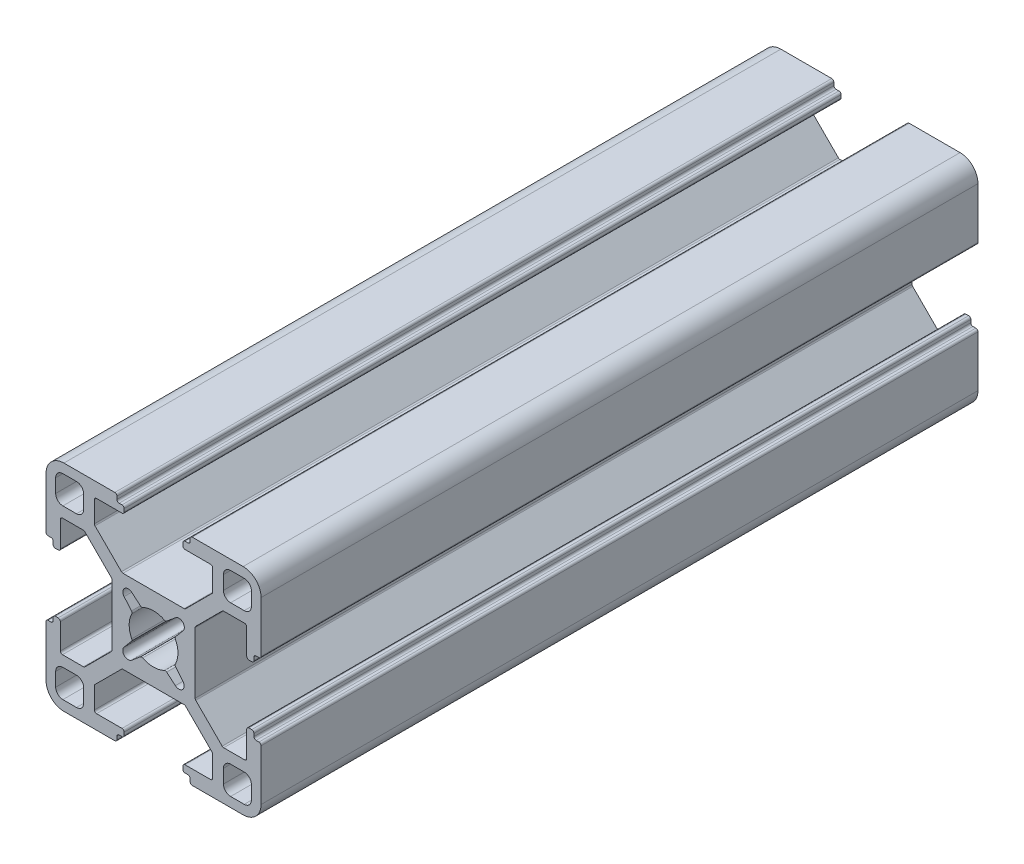
from build123d import *

# Parameters (mm, degrees)
EXTRUDE_1_DEPTH = 100


with BuildPart() as part:
    # 草图1 → 凸台-拉伸1 (new body)
    with BuildSketch(Plane.XY):
        with BuildLine():
            Line((14.3, 5.1), (14.7, 5.1))
            ThreePointArc((14.7, 5.1), (14.912132034, 5.187867966), (15, 5.4))
            Line((15, 5.4), (15, 12.5))
            ThreePointArc((15, 12.5), (14.267766953, 14.267766953), (12.5, 15))
            Line((12.5, 15), (5.4, 15))
            ThreePointArc((5.4, 15), (5.187867966, 14.912132034), (5.1, 14.7))
            Line((5.1, 14.7), (5.1, 14.3))
            ThreePointArc((5.1, 14.3), (5.012132034, 14.087867966), (4.8, 14))
            Line((4.8, 14), (4.4, 14))
            ThreePointArc((4.4, 14), (4.187867966, 13.912132034), (4.1, 13.7))
            Line((4.1, 13.7), (4.1, 13.3))
            ThreePointArc((4.1, 13.3), (4.187867966, 13.087867966), (4.4, 13))
            Line((4.4, 13), (7.95, 13))
            ThreePointArc((7.95, 13), (8.162132034, 12.912132034), (8.25, 12.7))
            Line((8.25, 12.7), (8.25, 9.788477631))
            ThreePointArc((8.25, 9.788477631), (8.22716386, 9.673672601), (8.162132034, 9.576345597))
            Line((8.162132034, 9.576345597), (4.473654403, 5.887867966))
            ThreePointArc((4.473654403, 5.887867966), (4.376327399, 5.82283614), (4.261522369, 5.8))
            Line((4.261522369, 5.8), (0, 5.8))
            Line((0, 5.8), (-4.261522369, 5.8))
            ThreePointArc((-4.261522369, 5.8), (-4.376327399, 5.82283614), (-4.473654403, 5.887867966))
            Line((-4.473654403, 5.887867966), (-8.162132034, 9.576345597))
            ThreePointArc((-8.162132034, 9.576345597), (-8.22716386, 9.673672601), (-8.25, 9.788477631))
            Line((-8.25, 9.788477631), (-8.25, 12.7))
            ThreePointArc((-8.25, 12.7), (-8.162132034, 12.912132034), (-7.95, 13))
            Line((-7.95, 13), (-4.4, 13))
            ThreePointArc((-4.4, 13), (-4.187867966, 13.087867966), (-4.1, 13.3))
            Line((-4.1, 13.3), (-4.1, 13.7))
            ThreePointArc((-4.1, 13.7), (-4.187867966, 13.912132034), (-4.4, 14))
            Line((-4.4, 14), (-4.8, 14))
            ThreePointArc((-4.8, 14), (-5.012132034, 14.087867966), (-5.1, 14.3))
            Line((-5.1, 14.3), (-5.1, 14.7))
            ThreePointArc((-5.1, 14.7), (-5.187867966, 14.912132034), (-5.4, 15))
            Line((-5.4, 15), (-12.5, 15))
            ThreePointArc((-12.5, 15), (-14.267766953, 14.267766953), (-15, 12.5))
            Line((-15, 12.5), (-15, 5.4))
            ThreePointArc((-15, 5.4), (-14.912132034, 5.187867966), (-14.7, 5.1))
            Line((-14.7, 5.1), (-14.3, 5.1))
            ThreePointArc((-14.3, 5.1), (-14.087867966, 5.012132034), (-14, 4.8))
            Line((-14, 4.8), (-14, 4.4))
            ThreePointArc((-14, 4.4), (-13.912132034, 4.187867966), (-13.7, 4.1))
            Line((-13.7, 4.1), (-13.3, 4.1))
            ThreePointArc((-13.3, 4.1), (-13.087867966, 4.187867966), (-13, 4.4))
            Line((-13, 4.4), (-13, 7.95))
            ThreePointArc((-13, 7.95), (-12.912132034, 8.162132034), (-12.7, 8.25))
            Line((-12.7, 8.25), (-9.788477631, 8.25))
            ThreePointArc((-9.788477631, 8.25), (-9.673672601, 8.22716386), (-9.576345597, 8.162132034))
            Line((-9.576345597, 8.162132034), (-5.887867966, 4.473654403))
            ThreePointArc((-5.887867966, 4.473654403), (-5.82283614, 4.376327399), (-5.8, 4.261522369))
            Line((-5.8, 4.261522369), (-5.8, 0))
            Line((-5.8, 0), (-5.8, -4.261522369))
            ThreePointArc((-5.8, -4.261522369), (-5.82283614, -4.376327399), (-5.887867966, -4.473654403))
            Line((-5.887867966, -4.473654403), (-9.576345597, -8.162132034))
            ThreePointArc((-9.576345597, -8.162132034), (-9.673672601, -8.22716386), (-9.788477631, -8.25))
            Line((-9.788477631, -8.25), (-12.7, -8.25))
            ThreePointArc((-12.7, -8.25), (-12.912132034, -8.162132034), (-13, -7.95))
            Line((-13, -7.95), (-13, -4.4))
            ThreePointArc((-13, -4.4), (-13.087867966, -4.187867966), (-13.3, -4.1))
            Line((-13.3, -4.1), (-13.7, -4.1))
            ThreePointArc((-13.7, -4.1), (-13.912132034, -4.187867966), (-14, -4.4))
            Line((-14, -4.4), (-14, -4.8))
            ThreePointArc((-14, -4.8), (-14.087867966, -5.012132034), (-14.3, -5.1))
            Line((-14.3, -5.1), (-14.7, -5.1))
            ThreePointArc((-14.7, -5.1), (-14.912132034, -5.187867966), (-15, -5.4))
            Line((-15, -5.4), (-15, -12.5))
            ThreePointArc((-15, -12.5), (-14.267766953, -14.267766953), (-12.5, -15))
            Line((-12.5, -15), (-5.4, -15))
            ThreePointArc((-5.4, -15), (-5.187867966, -14.912132034), (-5.1, -14.7))
            Line((-5.1, -14.7), (-5.1, -14.3))
            ThreePointArc((-5.1, -14.3), (-5.012132034, -14.087867966), (-4.8, -14))
            Line((-4.8, -14), (-4.4, -14))
            ThreePointArc((-4.4, -14), (-4.187867966, -13.912132034), (-4.1, -13.7))
            Line((-4.1, -13.7), (-4.1, -13.3))
            ThreePointArc((-4.1, -13.3), (-4.187867966, -13.087867966), (-4.4, -13))
            Line((-4.4, -13), (-7.95, -13))
            ThreePointArc((-7.95, -13), (-8.162132034, -12.912132034), (-8.25, -12.7))
            Line((-8.25, -12.7), (-8.25, -9.664213562))
            Line((-8.25, -9.664213562), (-4.385786438, -5.8))
            Line((-4.385786438, -5.8), (0, -5.8))
            Line((0, -5.8), (4.385786438, -5.8))
            Line((4.385786438, -5.8), (8.162132034, -9.576345597))
            ThreePointArc((8.162132034, -9.576345597), (8.22716386, -9.673672601), (8.25, -9.788477631))
            Line((8.25, -9.788477631), (8.25, -12.7))
            ThreePointArc((8.25, -12.7), (8.162132034, -12.912132034), (7.95, -13))
            Line((7.95, -13), (4.4, -13))
            ThreePointArc((4.4, -13), (4.187867966, -13.087867966), (4.1, -13.3))
            Line((4.1, -13.3), (4.1, -13.7))
            ThreePointArc((4.1, -13.7), (4.187867966, -13.912132034), (4.4, -14))
            Line((4.4, -14), (4.8, -14))
            ThreePointArc((4.8, -14), (5.012132034, -14.087867966), (5.1, -14.3))
            Line((5.1, -14.3), (5.1, -14.7))
            ThreePointArc((5.1, -14.7), (5.187867966, -14.912132034), (5.4, -15))
            Line((5.4, -15), (12.5, -15))
            ThreePointArc((12.5, -15), (14.267766953, -14.267766953), (15, -12.5))
            Line((15, -12.5), (15, -5.4))
            ThreePointArc((15, -5.4), (14.912132034, -5.187867966), (14.7, -5.1))
            Line((14.7, -5.1), (14.3, -5.1))
            ThreePointArc((14.3, -5.1), (14.087867966, -5.012132034), (14, -4.8))
            Line((14, -4.8), (14, -4.4))
            ThreePointArc((14, -4.4), (13.912132034, -4.187867966), (13.7, -4.1))
            Line((13.7, -4.1), (13.3, -4.1))
            ThreePointArc((13.3, -4.1), (13.087867966, -4.187867966), (13, -4.4))
            Line((13, -4.4), (13, -7.95))
            ThreePointArc((13, -7.95), (12.912132034, -8.162132034), (12.7, -8.25))
            Line((12.7, -8.25), (9.788477631, -8.25))
            ThreePointArc((9.788477631, -8.25), (9.673672601, -8.22716386), (9.576345597, -8.162132034))
            Line((9.576345597, -8.162132034), (5.887867966, -4.473654403))
            ThreePointArc((5.887867966, -4.473654403), (5.82283614, -4.376327399), (5.8, -4.261522369))
            Line((5.8, -4.261522369), (5.8, 0))
            Line((5.8, 0), (5.8, 4.261522369))
            ThreePointArc((5.8, 4.261522369), (5.82283614, 4.376327399), (5.887867966, 4.473654403))
            Line((5.887867966, 4.473654403), (9.576345597, 8.162132034))
            ThreePointArc((9.576345597, 8.162132034), (9.673672601, 8.22716386), (9.788477631, 8.25))
            Line((9.788477631, 8.25), (12.7, 8.25))
            ThreePointArc((12.7, 8.25), (12.912132034, 8.162132034), (13, 7.95))
            Line((13, 7.95), (13, 4.4))
            ThreePointArc((13, 4.4), (13.087867966, 4.187867966), (13.3, 4.1))
            Line((13.3, 4.1), (13.7, 4.1))
            ThreePointArc((13.7, 4.1), (13.912132034, 4.187867966), (14, 4.4))
            Line((14, 4.4), (14, 4.8))
            ThreePointArc((14, 4.8), (14.087867966, 5.012132034), (14.3, 5.1))
        make_face()
        with BuildLine():
            Line((-13.65, 12.65), (-13.65, 10.75))
            ThreePointArc((-13.65, 10.75), (-13.357106781, 10.042893219), (-12.65, 9.75))
            Line((-12.65, 9.75), (-10.75, 9.75))
            ThreePointArc((-10.75, 9.75), (-10.042893219, 10.042893219), (-9.75, 10.75))
            Line((-9.75, 10.75), (-9.75, 12.65))
            ThreePointArc((-9.75, 12.65), (-10.042893219, 13.357106781), (-10.75, 13.65))
            Line((-10.75, 13.65), (-12.65, 13.65))
            ThreePointArc((-12.65, 13.65), (-13.357106781, 13.357106781), (-13.65, 12.65))
        make_face(mode=Mode.SUBTRACT)
        with BuildLine():
            Line((12.65, 13.65), (10.75, 13.65))
            ThreePointArc((10.75, 13.65), (10.042893219, 13.357106781), (9.75, 12.65))
            Line((9.75, 12.65), (9.75, 10.75))
            ThreePointArc((9.75, 10.75), (10.042893219, 10.042893219), (10.75, 9.75))
            Line((10.75, 9.75), (12.65, 9.75))
            ThreePointArc((12.65, 9.75), (13.357106781, 10.042893219), (13.65, 10.75))
            Line((13.65, 10.75), (13.65, 12.65))
            ThreePointArc((13.65, 12.65), (13.357106781, 13.357106781), (12.65, 13.65))
        make_face(mode=Mode.SUBTRACT)
        with BuildLine():
            Line((-12.65, -13.65), (-10.75, -13.65))
            ThreePointArc((-10.75, -13.65), (-10.042893219, -13.357106781), (-9.75, -12.65))
            Line((-9.75, -12.65), (-9.75, -10.75))
            ThreePointArc((-9.75, -10.75), (-10.042893219, -10.042893219), (-10.75, -9.75))
            Line((-10.75, -9.75), (-12.65, -9.75))
            ThreePointArc((-12.65, -9.75), (-13.357106781, -10.042893219), (-13.65, -10.75))
            Line((-13.65, -10.75), (-13.65, -12.65))
            ThreePointArc((-13.65, -12.65), (-13.357106781, -13.357106781), (-12.65, -13.65))
        make_face(mode=Mode.SUBTRACT)
        with BuildLine():
            Line((9.75, -10.75), (9.75, -12.65))
            ThreePointArc((9.75, -12.65), (10.042893219, -13.357106781), (10.75, -13.65))
            Line((10.75, -13.65), (12.65, -13.65))
            ThreePointArc((12.65, -13.65), (13.357106781, -13.357106781), (13.65, -12.65))
            Line((13.65, -12.65), (13.65, -10.75))
            ThreePointArc((13.65, -10.75), (13.357106781, -10.042893219), (12.65, -9.75))
            Line((12.65, -9.75), (10.75, -9.75))
            ThreePointArc((10.75, -9.75), (10.042893219, -10.042893219), (9.75, -10.75))
        make_face(mode=Mode.SUBTRACT)
        with BuildLine():
            Line((-1.830036904, 3.088942258), (-3.049302452, 4.116700743))
            ThreePointArc((-3.049302452, 4.116700743), (-4.056726113, 4.07498138), (-4.102968262, 3.067755188))
            Line((-4.102968262, 3.067755188), (-3.080694485, 1.843887423))
            ThreePointArc((-3.080694485, 1.843887423), (-3.012976865, 1.686465733), (-3.042485539, 1.517656662))
            ThreePointArc((-3.042485539, 1.517656662), (-3.399991432, 0.007632807), (-3.049268961, -1.503980984))
            ThreePointArc((-3.049268961, -1.503980984), (-3.020518517, -1.672920845), (-3.088942258, -1.830036904))
            Line((-3.088942258, -1.830036904), (-4.116700743, -3.049302452))
            ThreePointArc((-4.116700743, -3.049302452), (-4.07498138, -4.056726113), (-3.067755188, -4.102968262))
            Line((-3.067755188, -4.102968262), (-1.843887423, -3.080694485))
            ThreePointArc((-1.843887423, -3.080694485), (-1.686465733, -3.012976865), (-1.517656662, -3.042485539))
            ThreePointArc((-1.517656662, -3.042485539), (-0.007632807, -3.399991432), (1.503980984, -3.049268961))
            ThreePointArc((1.503980984, -3.049268961), (1.672920845, -3.020518517), (1.830036904, -3.088942258))
            Line((1.830036904, -3.088942258), (3.049302452, -4.116700743))
            ThreePointArc((3.049302452, -4.116700743), (4.056726113, -4.07498138), (4.102968262, -3.067755188))
            Line((4.102968262, -3.067755188), (3.080694485, -1.843887423))
            ThreePointArc((3.080694485, -1.843887423), (3.012976865, -1.686465733), (3.042485539, -1.517656662))
            ThreePointArc((3.042485539, -1.517656662), (3.399991432, -0.007632807), (3.049268961, 1.503980984))
            ThreePointArc((3.049268961, 1.503980984), (3.020518517, 1.672920845), (3.088942258, 1.830036904))
            Line((3.088942258, 1.830036904), (4.116700743, 3.049302452))
            ThreePointArc((4.116700743, 3.049302452), (4.07498138, 4.056726113), (3.067755188, 4.102968262))
            Line((3.067755188, 4.102968262), (1.843887423, 3.080694485))
            ThreePointArc((1.843887423, 3.080694485), (1.686465733, 3.012976865), (1.517656662, 3.042485539))
            ThreePointArc((1.517656662, 3.042485539), (0.007632807, 3.399991432), (-1.503980984, 3.049268961))
            ThreePointArc((-1.503980984, 3.049268961), (-1.672920845, 3.020518517), (-1.830036904, 3.088942258))
        make_face(mode=Mode.SUBTRACT)
    extrude(amount=EXTRUDE_1_DEPTH)


solid = part.part
